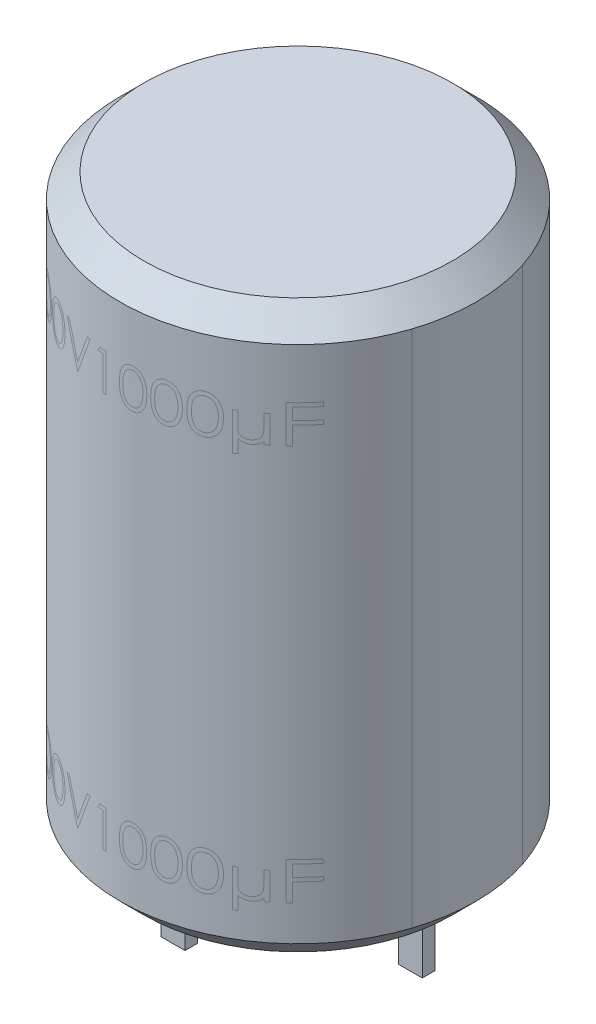
from build123d import *

# Parameters (mm, degrees)
CROQUIS1_R              = 11.25
SALIENTE_EXTRUIR1_DEPTH = 35.8
CHAFL_N1_SIZE           = 1.5
CROQUIS3_W              = 1.5
CROQUIS3_H              = 0.8
SALIENTE_EXTRUIR2_DEPTH = 7


with BuildPart() as part:
    # Croquis1 → Saliente-Extruir1 (new body)
    with BuildSketch(Plane(origin=(0, 0, 0), x_dir=(1, 0, 0), z_dir=(0, 1, 0))):
        with Locations(Location((0, 0, 0), (0, 0, 90))):
            Circle(CROQUIS1_R)
    extrude(amount=SALIENTE_EXTRUIR1_DEPTH)

    # Chaflán1
    chafl_n1_edges = [part.edges().sort_by_distance(p)[0] for p in [
        (0, 0, 11.25),
        (0, 35.8, 11.25),
    ]]
    chamfer(chafl_n1_edges, length=CHAFL_N1_SIZE)

    # Croquis3 → Saliente-Extruir2 (add)
    with BuildSketch(Plane.XZ):
        with Locations((-4.5, 3)):
            Rectangle(CROQUIS3_W, CROQUIS3_H)
        with Locations((4.5, -3)):
            Rectangle(CROQUIS3_W, CROQUIS3_H)
    extrude(amount=SALIENTE_EXTRUIR2_DEPTH)


solid = part.part
